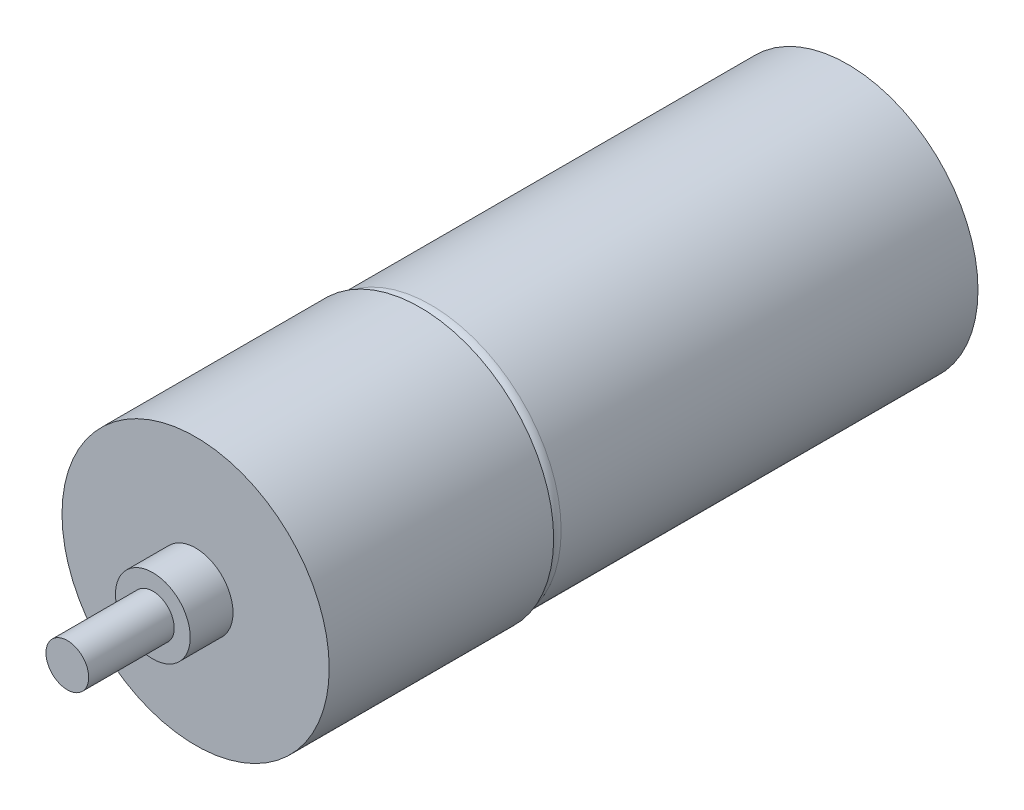
from build123d import *

# Parameters (mm, degrees)
SKETCH2_R               = 12.2
BOSS_EXTRUDE1_DEPTH     = 31
FILLET1_R               = 1
SKETCH3_R               = 12.5
BOSS_EXTRUDE2_DEPTH     = 21
SKETCH4_R               = 3.5
BOSS_EXTRUDE3_DEPTH     = 4
SKETCH5_R               = 2
BOSS_EXTRUDE4_DEPTH     = 8
BOSS_EXTRUDE5_START     = 10
SKETCH6_R               = 12.2
BOSS_EXTRUDE5_DEPTH     = 10
CUT_EXTRUDE1_DEPTH      = 20
CUT_EXTRUDE1_DEPTH_BACK = 19
SKETCH7_W               = 2.212937173
SKETCH7_H               = 31.307930015


with BuildPart() as part:
    # Sketch2 → Boss-Extrude1 (new body)
    with BuildSketch(Plane.XY):
        Circle(SKETCH2_R)
    extrude(amount=BOSS_EXTRUDE1_DEPTH)

    # Fillet1
    fillet1_edges = [part.edges().sort_by_distance(p)[0] for p in [
        (-12.2, 0, 31),
    ]]
    fillet(fillet1_edges, radius=FILLET1_R)

    # Sketch3 → Boss-Extrude2 (add)
    with BuildSketch(Plane.XY.offset(31)):
        with Locations(Location((0, 0, 0), (0, 0, 180))):
            Circle(SKETCH3_R)
    extrude(amount=BOSS_EXTRUDE2_DEPTH)

    # Sketch4 → Boss-Extrude3 (add)
    with BuildSketch(Plane.XY.offset(52)):
        Circle(SKETCH4_R)
    extrude(amount=BOSS_EXTRUDE3_DEPTH)

    # Sketch5 → Boss-Extrude4 (add)
    with BuildSketch(Plane.XY.offset(56)):
        Circle(SKETCH5_R)
    extrude(amount=BOSS_EXTRUDE4_DEPTH)

    # Sketch6 → Boss-Extrude5 (add)
    with BuildSketch(Plane(origin=(0, 0, 0), x_dir=(-1, 0, 0), z_dir=(0, 0, -1)).offset(BOSS_EXTRUDE5_START)):
        Circle(SKETCH6_R)
    extrude(amount=-BOSS_EXTRUDE5_DEPTH)

    # Sketch7 → Cut-Extrude1 (cut, two sides: drawn at the far end of the back side and taken through both)
    with BuildSketch(Plane(origin=(0, 0, 0), x_dir=(0, 0, -1), z_dir=(1, 0, 0)).offset(-CUT_EXTRUDE1_DEPTH_BACK)):
        with Locations((10.106468587, 3.153965008)):
            Rectangle(SKETCH7_W, SKETCH7_H)
    extrude(amount=CUT_EXTRUDE1_DEPTH + CUT_EXTRUDE1_DEPTH_BACK, mode=Mode.SUBTRACT)


solid = part.part
